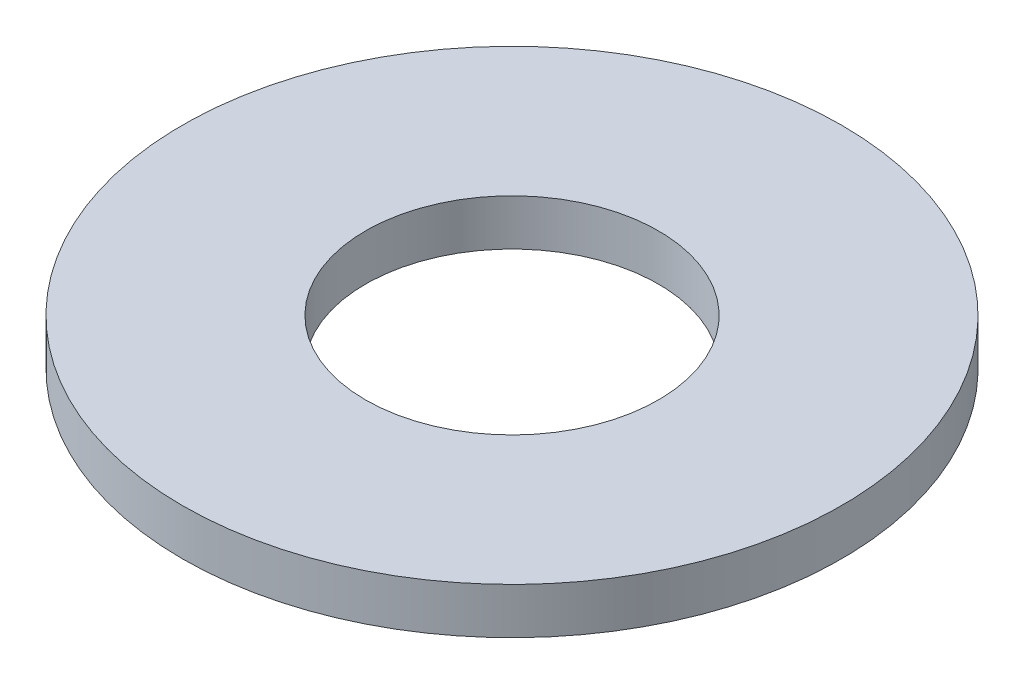
from build123d import *

# Parameters (mm, degrees)
SKETCH1_R         = 7.14375
SKETCH1_R_2       = 3.175
WASHER_BODY_DEPTH = 1


with BuildPart() as part:
    # Sketch1 → Washer_Body (new body)
    with BuildSketch(Plane(origin=(0, 0, 0), x_dir=(1, 0, 0), z_dir=(0, 1, 0))):
        with Locations(Location((0, 0, 0), (0, 0, 270))):
            Circle(SKETCH1_R)
        with Locations(Location((0, 0, 0), (0, 0, 270))):
            Circle(SKETCH1_R_2, mode=Mode.SUBTRACT)
    extrude(amount=WASHER_BODY_DEPTH)


solid = part.part
